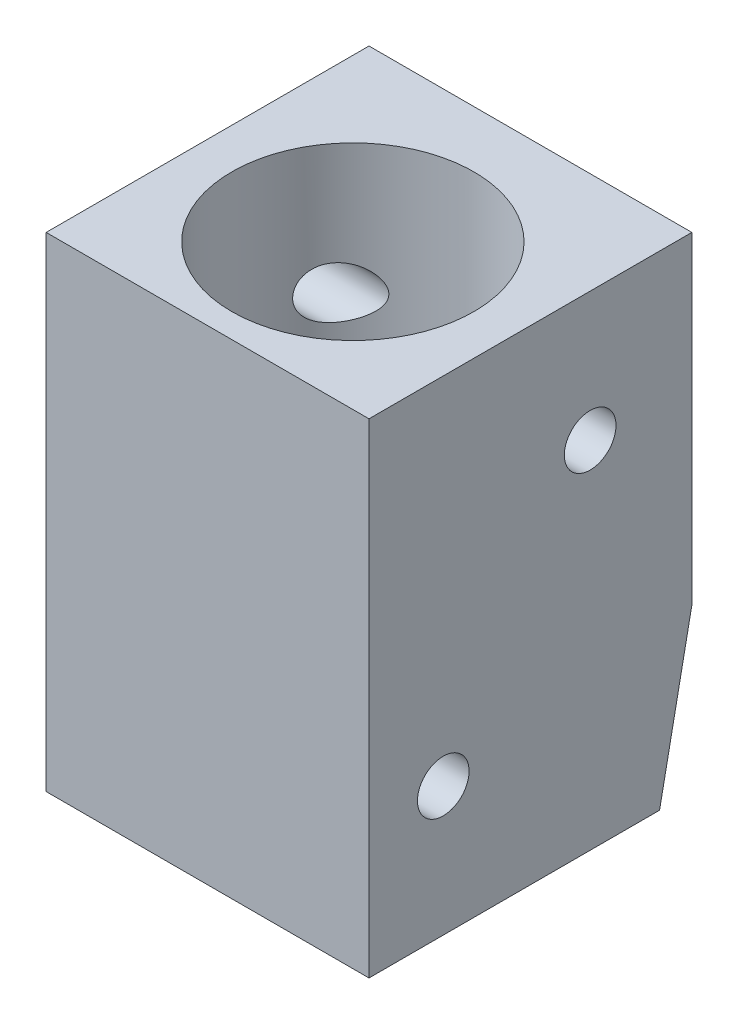
from build123d import *

# Parameters (mm, degrees)
SKETCH1_W                      = 10
SKETCH1_H                      = 10
BOSS_EXTRUDE1_DEPTH            = 15
F_97_0_0059_DIAMETER_HOLE1_D   = 7.499999986
CUT_EXTRUDE1_DEPTH             = 15
F_0_80_TAPPED_HOLE1_D          = 1.19126
F_0_80_TAPPED_HOLE1_DEPTH      = 4.95
F_0_80_TAPPED_HOLE1_TIP        = 0.357890611
M2X0_4_TAPPED_HOLE1_AT_2_COUNT = 2
M2X0_4_TAPPED_HOLE1_AT_2_PITCH = 8.348802309


with BuildPart() as part:
    # Sketch1 → Boss-Extrude1 (new body)
    with BuildSketch(Plane(origin=(0, 0, 0), x_dir=(1, 0, 0), z_dir=(0, 1, 0))):
        with Locations((5, 5)):
            Rectangle(SKETCH1_W, SKETCH1_H)
    extrude(amount=BOSS_EXTRUDE1_DEPTH)

    # #97 (0.0059) Diameter Hole1 (through all)
    with Locations(Plane(origin=(0, 15, 0), x_dir=(1, 0, 0), z_dir=(0, 1, 0))):
        with Locations((5, 4.5)):
            Hole(F_97_0_0059_DIAMETER_HOLE1_D / 2)

    # Sketch4 → Cut-Extrude1 (cut)
    with BuildSketch(Plane(origin=(10, 0, 0), x_dir=(0, 0, -1), z_dir=(1, 0, 0))):
        Polygon((10, 0), (9, 0), (10, 5.000000002), align=None)
    extrude(amount=-CUT_EXTRUDE1_DEPTH, mode=Mode.SUBTRACT)

    # #0-80 Tapped Hole1
    with Locations(Plane(origin=(0, -1.73076923, -8.653846154), x_dir=(-1, 0, 0), z_dir=(0, -0.19611613506937778, -0.9805806757046814))):
        with Locations((-5, 5.664064731), (-5, 2.864064731)):
            Hole(F_0_80_TAPPED_HOLE1_D / 2, depth=F_0_80_TAPPED_HOLE1_DEPTH)
            with Locations((0, 0, -(F_0_80_TAPPED_HOLE1_DEPTH + F_0_80_TAPPED_HOLE1_TIP / 2))):  # 118° drill point
                Cone(0, F_0_80_TAPPED_HOLE1_D / 2, F_0_80_TAPPED_HOLE1_TIP, mode=Mode.SUBTRACT)

    # Sketch7 → M2x0.4 Tapped Hole1 (revolve, cut)
    with BuildSketch(Plane(origin=(10, 4, -2.3), x_dir=(0, 0, -1), z_dir=(0, 1, 0))):
        Polygon((0, 0), (0, 5.680688495), (0.8, 5.2), (0.8, 0), align=None)
    m2x0_4_tapped_hole1 = revolve(axis=Axis((16.35, 4, -2.3), (-1, 0, 0)), mode=Mode.SUBTRACT)

    # M2x0.4 Tapped Hole1 at 2: M2x0.4 Tapped Hole1 ×2
    with Locations(*[Vector(0, 0.838443616300637, -0.5449883505954144) * (i * M2X0_4_TAPPED_HOLE1_AT_2_PITCH) for i in range(1, M2X0_4_TAPPED_HOLE1_AT_2_COUNT)]):
        add(m2x0_4_tapped_hole1, mode=Mode.SUBTRACT)

    # Mirror1: M2x0.4 Tapped Hole1 across plane
    add(m2x0_4_tapped_hole1.mirror(Plane(origin=(5, 0, 0), x_dir=(0, 0, 1), z_dir=(1, 0, 0))), mode=Mode.SUBTRACT)

    # Mirror1 copy 1 sketch → Mirror1 copy 1 (revolve, cut)
    with BuildSketch(Plane(origin=(0, 11, -6.85), x_dir=(0, 0, -1), z_dir=(0, 1, 0))):
        Polygon((0, 0), (0, -5.680688495), (0.8, -5.2), (0.8, 0), align=None)
    revolve(axis=Axis((-6.35, 11, -6.85), (-1, 0, 0)), mode=Mode.SUBTRACT)


solid = part.part
